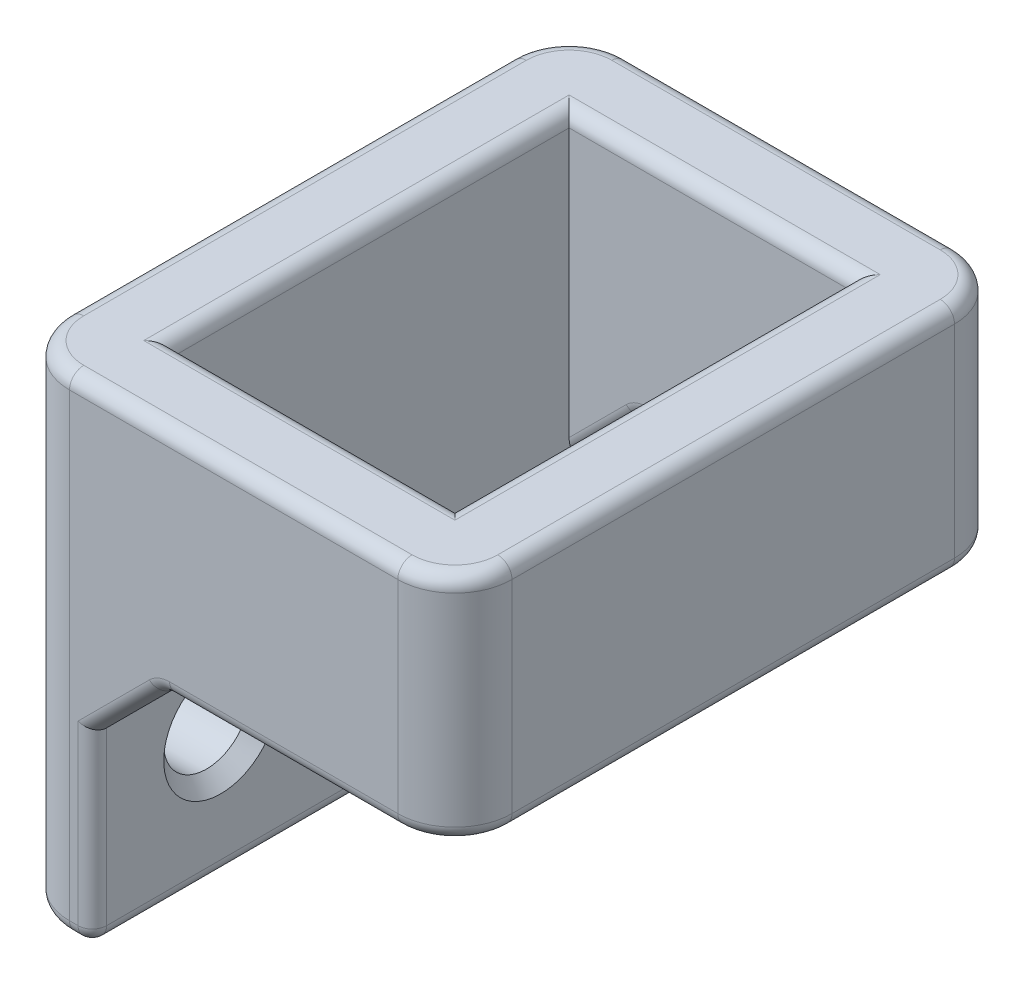
from build123d import *

# Parameters (mm, degrees)
SKETCH1_W           = 15.5
SKETCH1_H           = 19.5
SKETCH1_W_2         = 9.9
SKETCH1_H_2         = 13.9
BOSS_EXTRUDE1_DEPTH = 4.05
SKETCH2_W           = 19.5
SKETCH2_H           = 9
SKETCH2_R           = 1.5
BOSS_EXTRUDE2_DEPTH = 2.8
CHAMFER1_SIZE       = 2.5
FILLET1_R           = 2
FILLET2_R           = 0.5
CHAMFER2_SIZE       = 0.5


with BuildPart() as part:
    # Sketch1 → Boss-Extrude1 (new, symmetric)
    with BuildSketch(Plane(origin=(0, 0, 0), x_dir=(1, 0, 0), z_dir=(0, 1, 0))):
        Rectangle(SKETCH1_W, SKETCH1_H)
        Rectangle(SKETCH1_W_2, SKETCH1_H_2, mode=Mode.SUBTRACT)
    extrude(amount=BOSS_EXTRUDE1_DEPTH, both=True)

    # Sketch2 → Boss-Extrude2 (add)
    with BuildSketch(Plane.ZY.offset(7.75)):
        with Locations((0, -8.55)):
            Rectangle(SKETCH2_W, SKETCH2_H)
        with Locations((-5.25, -8.55)):
            Circle(SKETCH2_R, mode=Mode.SUBTRACT)
        with Locations(Location((5.25, -8.55, 0), (0, 0, 180))):
            Circle(SKETCH2_R, mode=Mode.SUBTRACT)
    extrude(amount=-BOSS_EXTRUDE2_DEPTH)

    # Chamfer1
    chamfer1_edges = [part.edges().sort_by_distance(p)[0] for p in [
        (-4.95, -4.05, -8.35),
        (-4.95, -4.05, 8.35),
    ]]
    chamfer(chamfer1_edges, length=CHAMFER1_SIZE)

    # Fillet1
    fillet1_edges = [part.edges().sort_by_distance(p)[0] for p in [
        (-7.75, -4.5, -9.75),
        (7.75, 0, -9.75),
        (7.75, 0, 9.75),
        (-7.75, -4.5, 9.75),
    ]]
    fillet(fillet1_edges, radius=FILLET1_R)

    # Fillet2
    fillet2_edges = [part.edges().sort_by_distance(p)[0] for p in [
        (4.95, -4.05, 0),
        (1.25, -4.05, -6.95),
        (-4.95, 4.05, 0),
        (0, 4.05, 6.95),
        (4.95, 4.05, 0),
        (0, 4.05, -6.95),
        (-5.35, -13.05, -9.75),
        (-4.95, -9.8, 9.75),
        (-4.95, -13.05, 0),
        (-5.35, -13.05, 9.75),
        (1.65, -4.05, 9.75),
        (1.25, -4.05, 6.95),
        (-2.45, -4.05, 8.35),
        (-2.45, -4.05, -8.35),
        (-4.95, -9.8, -9.75),
        (-3.7, -5.3, -9.75),
        (-3.7, -5.3, -6.95),
        (-3.7, -5.3, 6.95),
        (-3.7, -5.3, 9.75),
        (1.65, -4.05, -9.75),
        (0, 4.05, -9.75),
        (7.75, -4.05, 0),
        (7.164213562, -4.05, 9.164213562),
        (7.164213562, -4.05, -9.164213562),
        (7.75, 4.05, 0),
        (-7.75, 4.05, 0),
        (0, 4.05, 9.75),
        (-7.164213562, 4.05, 9.164213562),
        (-7.164213562, 4.05, -9.164213562),
        (7.164213562, 4.05, 9.164213562),
        (7.164213562, 4.05, -9.164213562),
        (-7.75, -13.05, 0),
        (-7.164213562, -13.05, 9.164213562),
        (-7.164213562, -13.05, -9.164213562),
    ]]
    fillet(fillet2_edges, radius=FILLET2_R)

    # Chamfer2
    chamfer2_edges = [part.edges().sort_by_distance(p)[0] for p in [
        (-4.95, -8.55, 6.75),
        (-4.95, -8.55, -6.75),
    ]]
    chamfer(chamfer2_edges, length=CHAMFER2_SIZE)


solid = part.part
